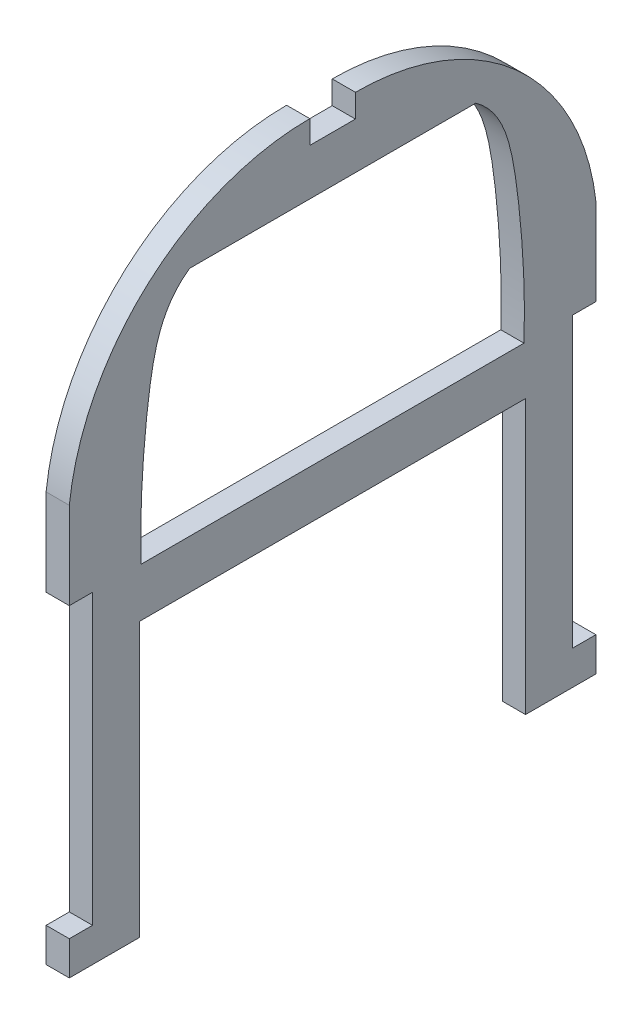
from build123d import *

# Parameters (mm, degrees)
BOSS_EXTRUDE1_DEPTH = 3


with BuildPart() as part:
    # Sketch1 → Boss-Extrude1 (new body)
    with BuildSketch(Plane(origin=(0, 0, 0), x_dir=(0, 0, -1), z_dir=(1, 0, 0))):
        with BuildLine():
            Line((-31.05, 0), (-24.75, 0))
            add(Edge.make_bspline(
                [(-18.5, 30), (-21.89992175, 27.622752142), (-23.338614893, 22.064542324), (-24.603317776, 11.688892455), (-24.929004991, 4.971961719), (-24.75, 0)],
                knots=[0, 0, 0, 0, 0.363581561, 0.525534897, 1, 1, 1, 1], degree=3))
            Line((-18.5, 30), (0, 30))
            Line((0, 30), (0, 36))
            Line((0, 36), (-2.95, 36))
            Line((-2.95, 36), (-2.95, 39))
            ThreePointArc((-2.95, 39), (-23.791917434, 31.05229513), (-34.05, 11.24514296))
            Line((-34.05, 11.24514296), (-34.05, 0))
            Line((-34.05, 0), (-31.05, 0))
        make_face()
        with BuildLine():
            add(Edge.make_bspline(
                [(18.5, 30), (21.89992175, 27.622752142), (23.338614893, 22.064542324), (24.603317776, 11.688892455), (24.929004991, 4.971961719), (24.75, 0)],
                knots=[0, 0, 0, 0, 0.363581561, 0.525534897, 1, 1, 1, 1], degree=3))
            Line((24.75, 0), (31.05, 0))
            Line((31.05, 0), (34.05, 0))
            Line((34.05, 0), (34.05, 11.24514296))
            ThreePointArc((34.05, 11.24514296), (23.791917434, 31.05229513), (2.95, 39))
            Line((2.95, 39), (2.95, 36))
            Line((2.95, 36), (0, 36))
            Line((0, 36), (0, 30))
            Line((0, 30), (18.5, 30))
        make_face()
        Polygon((24.75, 0), (0, 0), (0, -6.3), (24.95, -6.3), (24.95, -41.7), (34.05, -41.7), (34.05, -37.3), (31.05, -37.3), (31.05, 0), align=None)
        Polygon((0, 0), (-24.75, 0), (-31.05, 0), (-31.05, -37.3), (-34.05, -37.3), (-34.05, -41.7), (-24.95, -41.7), (-24.95, -6.3), (0, -6.3), align=None)
    extrude(amount=BOSS_EXTRUDE1_DEPTH)


solid = part.part
